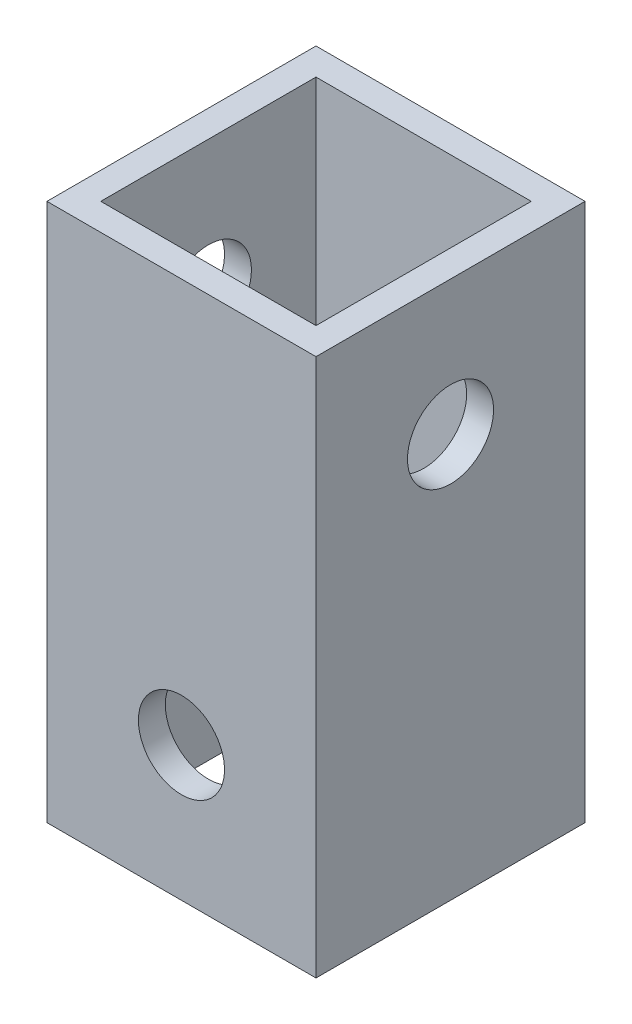
from build123d import *

# Parameters (mm, degrees)
SKETCH_1_W          = 10
SKETCH_1_H          = 10
SKETCH_1_W_2        = 8
SKETCH_1_H_2        = 8
EXTRUDE_1_DEPTH     = 20
SKETCH_2_R          = 1.6
CUT_EXTRUDE_1_DEPTH = 20
SKETCH_3_R          = 1.6
CUT_EXTRUDE_2_DEPTH = 20


with BuildPart() as part:
    # ｽｹｯﾁ1 → ﾎﾞｽ - 押し出し1 (new body)
    with BuildSketch(Plane(origin=(0, 0, 0), x_dir=(1, 0, 0), z_dir=(0, 1, 0))):
        Rectangle(SKETCH_1_W, SKETCH_1_H)
        Rectangle(SKETCH_1_W_2, SKETCH_1_H_2, mode=Mode.SUBTRACT)
    extrude(amount=EXTRUDE_1_DEPTH)

    # ｽｹｯﾁ2 → ｶｯﾄ - 押し出し1 (cut)
    with BuildSketch(Plane(origin=(0, 0, -5), x_dir=(-1, 0, 0), z_dir=(0, 0, -1))):
        with Locations((0, 5)):
            Circle(SKETCH_2_R)
    extrude(amount=-CUT_EXTRUDE_1_DEPTH, mode=Mode.SUBTRACT)

    # ｽｹｯﾁ3 → ｶｯﾄ - 押し出し2 (cut)
    with BuildSketch(Plane.ZY.offset(5)):
        with Locations((0, 15)):
            Circle(SKETCH_3_R)
    extrude(amount=-CUT_EXTRUDE_2_DEPTH, mode=Mode.SUBTRACT)


solid = part.part
